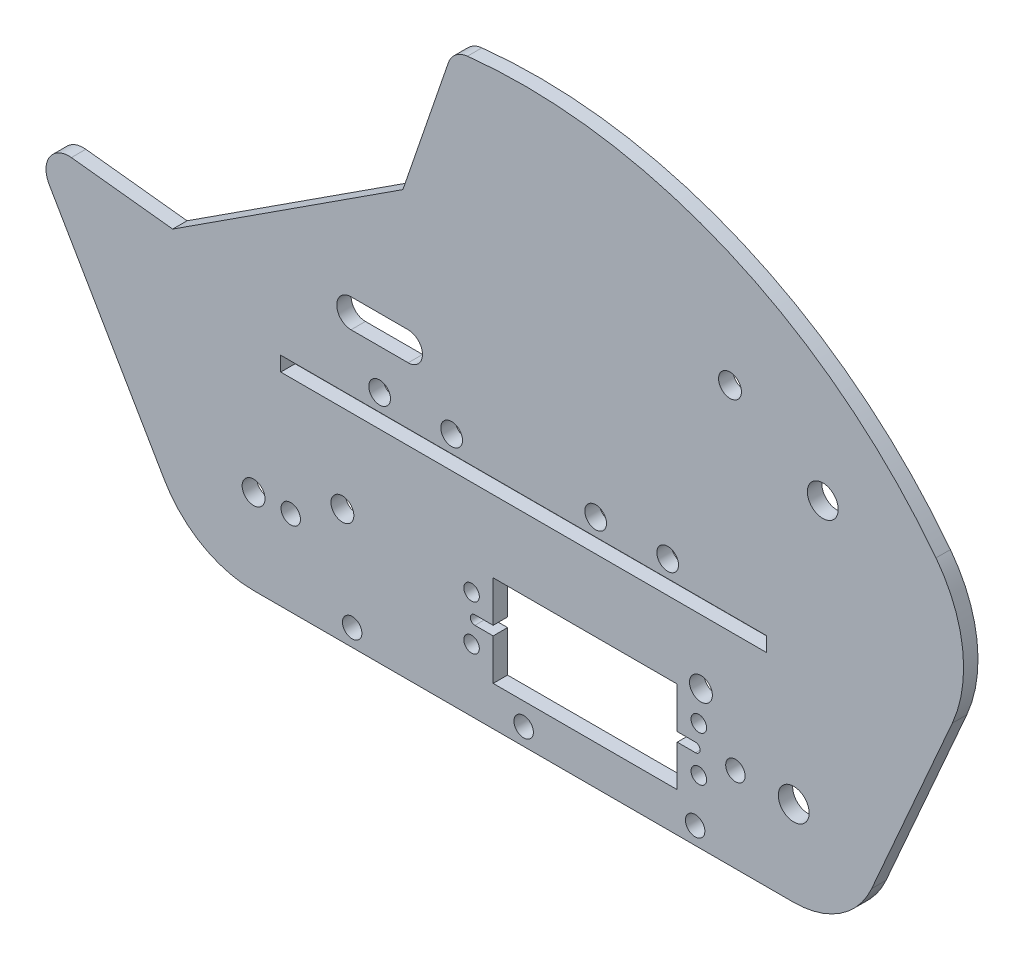
from build123d import *

# Parameters (mm, degrees)
SKETCH1_R           = 3.429
SKETCH1_R_2         = 2.54
BOSS_EXTRUDE1_DEPTH = 3.2004
SKETCH2_R           = 2.413
CUT_EXTRUDE1_DEPTH  = 3.2004
SKETCH5_R           = 1.7272
SKETCH5_W           = 40.894
SKETCH5_H           = 20.32
CUT_EXTRUDE3_DEPTH  = 203.721029268
CUT_EXTRUDE5_DEPTH  = 3.2004
SKETCH6_R           = 2.54
CUT_EXTRUDE4_DEPTH  = 203.721029268
SKETCH9_R           = 2.159
CUT_EXTRUDE6_DEPTH  = 3.2004
SKETCH10_W          = 107.95
SKETCH10_H          = 3.2512
CUT_EXTRUDE7_DEPTH  = 3.2004
SKETCH11_R          = 3.429
SKETCH11_R_2        = 2.54
CUT_EXTRUDE8_DEPTH  = 3.2004
CUT_EXTRUDE9_DEPTH  = 3.2004
SKETCH15_R          = 2.159
CUT_EXTRUDE10_DEPTH = 3.2004
BOSS_EXTRUDE2_DEPTH = 3.2004
FILLET1_R           = 5.08
CUT_EXTRUDE11_DEPTH = 3.2004
CUT_EXTRUDE12_DEPTH = 3.2004
FILLET3_R           = 5.08


with BuildPart() as part:
    # Sketch1 → Boss-Extrude1 (new body)
    with BuildSketch(Plane.XY):
        with BuildLine():
            Line((0, 0), (120.015, 0))
            ThreePointArc((120.015, 0), (130.351788396, 3.075697789), (137.325636158, 11.302152592))
            Line((137.325636158, 11.302152592), (155.2575, 52.11572))
            ThreePointArc((155.2575, 52.11572), (157.54731739, 67.602183396), (151.630955452, 82.09599151))
            ThreePointArc((151.630955452, 82.09599151), (60.0075, 127.266502568), (-31.615955452, 82.09599151))
            ThreePointArc((-31.615955452, 82.09599151), (-37.53231739, 67.602183396), (-35.2425, 52.11572))
            Line((-35.2425, 52.11572), (-17.310636158, 11.302152592))
            ThreePointArc((-17.310636158, 11.302152592), (-10.336788396, 3.075697789), (0, 0))
        make_face()
        with Locations((120.015, 18.90776)):
            Circle(SKETCH1_R, mode=Mode.SUBTRACT)
        with Locations((0, 18.90776)):
            Circle(SKETCH1_R_2, mode=Mode.SUBTRACT)
        with Locations((19.734727626, 25.566426992)):
            Circle(SKETCH1_R_2, mode=Mode.SUBTRACT)
    extrude(amount=BOSS_EXTRUDE1_DEPTH)

    # Sketch2 → Cut-Extrude1 (cut)
    with BuildSketch(Plane(origin=(0, 0, 0), x_dir=(-1, 0, 0), z_dir=(0, 0, -1))):
        with Locations((-92.0115, 52.11572)):
            Circle(SKETCH2_R)
        with Locations((-76.0095, 52.11572)):
            Circle(SKETCH2_R)
        with Locations((-44.0055, 52.11572)):
            Circle(SKETCH2_R)
        with Locations((-28.0035, 52.11572)):
            Circle(SKETCH2_R)
    extrude(amount=-CUT_EXTRUDE1_DEPTH, mode=Mode.SUBTRACT)

    # Sketch5 → Cut-Extrude3 (cut, through all)
    with BuildSketch(Plane(origin=(0, 0, 0), x_dir=(-1, 0, 0), z_dir=(0, 0, -1))):
        with Locations((-98.932021353, 23.907759967)):
            Circle(SKETCH5_R)
        with Locations((-48.432021353, 13.907760033)):
            Circle(SKETCH5_R)
        with Locations((-48.432021353, 23.907759967)):
            Circle(SKETCH5_R)
        with Locations((-98.932021353, 13.907760033)):
            Circle(SKETCH5_R)
        with Locations((-73.682021353, 18.90776)):
            Rectangle(SKETCH5_W, SKETCH5_H)
    extrude(amount=-CUT_EXTRUDE3_DEPTH, mode=Mode.SUBTRACT)

    # Sketch7 → Cut-Extrude5 (cut)
    with BuildSketch(Plane(origin=(0, 0, 0), x_dir=(-1, 0, 0), z_dir=(0, 0, -1))):
        with BuildLine():
            Line((-98.193021353, 19.92376), (-94.129021353, 19.92376))
            Line((-94.129021353, 19.92376), (-94.129021353, 17.89176))
            Line((-94.129021353, 17.89176), (-98.193021353, 17.89176))
            ThreePointArc((-98.193021353, 17.89176), (-99.209021353, 18.90776), (-98.193021353, 19.92376))
        make_face()
        with BuildLine():
            Line((-53.235021353, 19.92376), (-49.171021353, 19.92376))
            ThreePointArc((-49.171021353, 19.92376), (-48.155021353, 18.90776), (-49.171021353, 17.89176))
            Line((-49.171021353, 17.89176), (-53.235021353, 17.89176))
            Line((-53.235021353, 17.89176), (-53.235021353, 19.92376))
        make_face()
    extrude(amount=-CUT_EXTRUDE5_DEPTH, mode=Mode.SUBTRACT)

    # Sketch6 → Cut-Extrude4 (cut, through all)
    with BuildSketch(Plane(origin=(0, 0, 0), x_dir=(-1, 0, 0), z_dir=(0, 0, -1))):
        with Locations((-99.400822485, 30.809360937)):
            Circle(SKETCH6_R)
    extrude(amount=-CUT_EXTRUDE4_DEPTH, mode=Mode.SUBTRACT)

    # Sketch9 → Cut-Extrude6 (cut)
    with BuildSketch(Plane.XY.offset(3.2004)):
        with Locations((21.9075, 3.81)):
            Circle(SKETCH9_R)
        with Locations((60.0075, 3.81)):
            Circle(SKETCH9_R)
        with Locations((98.1075, 3.81)):
            Circle(SKETCH9_R)
    extrude(amount=-CUT_EXTRUDE6_DEPTH, mode=Mode.SUBTRACT)

    # Sketch10 → Cut-Extrude7 (cut)
    with BuildSketch(Plane.XY.offset(3.2004)):
        with Locations((60.0075, 46.68012)):
            Rectangle(SKETCH10_W, SKETCH10_H)
    extrude(amount=-CUT_EXTRUDE7_DEPTH, mode=Mode.SUBTRACT)

    # Sketch11 → Cut-Extrude8 (cut)
    with BuildSketch(Plane.XY.offset(3.2004)):
        with Locations((126.474462556, 80.535782848)):
            Circle(SKETCH11_R)
        with Locations((105.860285087, 92.437383759)):
            Circle(SKETCH11_R_2)
    extrude(amount=-CUT_EXTRUDE8_DEPTH, mode=Mode.SUBTRACT)

    # Sketch14 → Cut-Extrude9 (cut)
    with BuildSketch(Plane(origin=(0, 0, 0), x_dir=(-1, 0, 0), z_dir=(0, 0, -1))):
        with BuildLine():
            Line((-44.300963253, 126.193661773), (-33.172711709, 93.735154568))
            Line((-33.172711709, 93.735154568), (17.974883496, 60.568226691))
            Line((17.974883496, 60.568226691), (31.788532543, 81.870619617))
            ThreePointArc((31.788532543, 81.870619617), (-1.866863458, 111.567353903), (-44.300963253, 126.193661773))
        make_face()
    extrude(amount=-CUT_EXTRUDE9_DEPTH, mode=Mode.SUBTRACT)

    # Sketch15 → Cut-Extrude10 (cut)
    with BuildSketch(Plane.XY.offset(3.2004)):
        with Locations((8.255, 18.90776)):
            Circle(SKETCH15_R)
        with Locations((107.05592, 18.90776)):
            Circle(SKETCH15_R)
    extrude(amount=-CUT_EXTRUDE10_DEPTH, mode=Mode.SUBTRACT)

    # Sketch16 → Boss-Extrude2 (add)
    with BuildSketch(Plane.XY.offset(3.2004)):
        with BuildLine():
            Line((-45.041102147, 54.757414103), (-19.827237301, 11.4051976))
            ThreePointArc((-19.827237301, 11.4051976), (-11.436759498, 3.05471175), (0, 0))
            ThreePointArc((0, 0), (-10.916945649, 29.711492853), (-17.974883496, 60.568226691))
            Line((-17.974883496, 60.568226691), (-35.838426308, 88.116067724))
            ThreePointArc((-35.838426308, 88.116067724), (-39.004683679, 85.006183785), (-42.068546328, 81.795372437))
            ThreePointArc((-42.068546328, 81.795372437), (-48.007013112, 68.765867356), (-45.041102147, 54.757414103))
        make_face()
    extrude(amount=-BOSS_EXTRUDE2_DEPTH)

    # Fillet1
    fillet1_edges = [part.edges().sort_by_distance(p)[0] for p in [
        (44.300963253, 126.193661773, 1.6002),
        (-35.838426308, 88.116067724, 1.6002),
    ]]
    fillet(fillet1_edges, radius=FILLET1_R)

    # Sketch17 → Cut-Extrude11 (cut)
    with BuildSketch(Plane(origin=(0, 0, 0), x_dir=(-1, 0, 0), z_dir=(0, 0, -1))):
        with BuildLine():
            Line((-34.3535, 67.35572), (-21.6535, 67.35572))
            ThreePointArc((-21.6535, 67.35572), (-18.4785, 64.18072), (-21.6535, 61.00572))
            Line((-21.6535, 61.00572), (-34.3535, 61.00572))
            ThreePointArc((-34.3535, 61.00572), (-37.5285, 64.18072), (-34.3535, 67.35572))
        make_face()
    extrude(amount=-CUT_EXTRUDE11_DEPTH, mode=Mode.SUBTRACT)

    # Sketch18 → Cut-Extrude12 (cut)
    with BuildSketch(Plane(origin=(0, 0, 0), x_dir=(-1, 0, 0), z_dir=(0, 0, -1))):
        Polygon((39.398034495, 93.605433495), (17.974883496, 60.568226691), (70.53521478, 66.420124121), align=None)
    extrude(amount=-CUT_EXTRUDE12_DEPTH, mode=Mode.SUBTRACT)

    # Fillet3
    fillet3_edges = [part.edges().sort_by_distance(p)[0] for p in [
        (-48.023040183, 63.913691353, 1.6002),
    ]]
    fillet(fillet3_edges, radius=FILLET3_R)


solid = part.part
